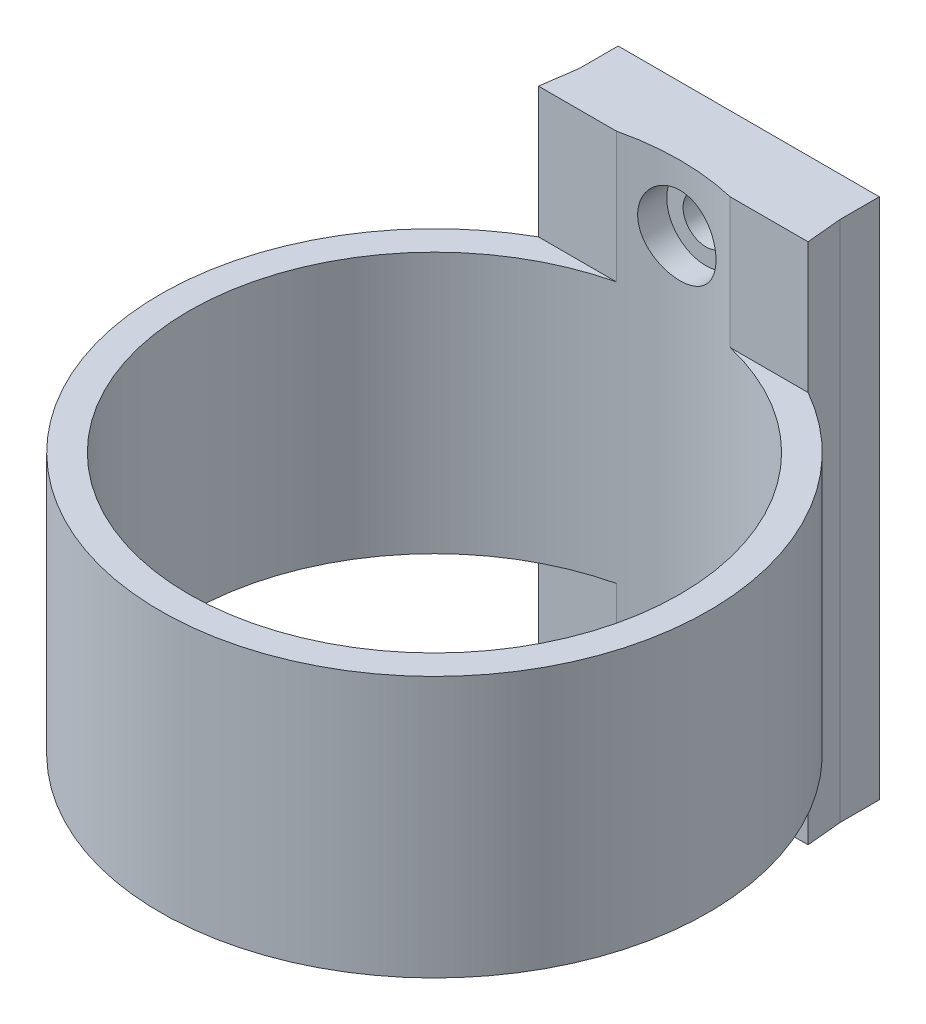
from build123d import *
from build123d.topology import SkipClean

# Parameters (mm, degrees)
SKETCH1_R               = 21
SKETCH1_R_2             = 18.8
BOSS_EXTRUDE1_DEPTH     = 20
SKETCH2_W               = 20
SKETCH2_H               = 40
SKETCH2_R               = 1.75
BOSS_EXTRUDE2_DEPTH     = 3
BOSS_EXTRUDE3_REACH     = 53.157
SKETCH6_R               = 1.75
CUT_EXTRUDE2_DEPTH      = 59.017238817
SKETCH8_R               = 3
CUT_EXTRUDE3_DEPTH      = 2.5
CUT_EXTRUDE4_DEPTH      = 44.783558558
CUT_EXTRUDE4_DEPTH_BACK = 44.783558558
SKETCH5_R               = 18.8


with BuildPart() as part:
    # Sketch1 → Boss-Extrude1 (new body)
    with BuildSketch(Plane(origin=(0, 0, 0), x_dir=(1, 0, 0), z_dir=(0, 1, 0))):
        with Locations(Location((0, 0, 0), (0, 0, 270))):
            Circle(SKETCH1_R)
        with Locations(Location((0, 0, 0), (0, 0, 270))):
            Circle(SKETCH1_R_2, mode=Mode.SUBTRACT)
    extrude(amount=BOSS_EXTRUDE1_DEPTH)


with BuildPart() as body_2:
    # Sketch2 → Boss-Extrude2 (new body)
    with BuildSketch(Plane(origin=(0, 0, -21), x_dir=(-1, 0, 0), z_dir=(0, 0, -1))):
        with Locations((-0.068597586, 10)):
            Rectangle(SKETCH2_W, SKETCH2_H)
        with Locations((0, 25)):
            Circle(SKETCH2_R, mode=Mode.SUBTRACT)
        with Locations((0, -5)):
            Circle(SKETCH2_R, mode=Mode.SUBTRACT)
    extrude(amount=BOSS_EXTRUDE2_DEPTH)

    # Boss-Extrude3: up to this face of the body (flat: up to its plane)
    boss_extrude3_end = Plane(body_2.part.faces().sort_by_distance((0.068597586, -10, -22.5))[0])
    # Sketch3 → Boss-Extrude3 (add, up to the picked face)
    with BuildSketch(Plane(origin=(0, 30, 0), x_dir=(1, 0, 0), z_dir=(0, 1, 0)), mode=Mode.PRIVATE) as boss_extrude3_sk1:
        Polygon((-9.931402414, 21), (-10.322711145, 18.287745477), (10.322711145, 18.287745477), (10.068597586, 21), align=None)
    boss_extrude3_tool1 = split(extrude(boss_extrude3_sk1.sketch, amount=-BOSS_EXTRUDE3_REACH, mode=Mode.PRIVATE), bisect_by=boss_extrude3_end, keep=Keep.BOTH, mode=Mode.PRIVATE)

    add(part.part)  # Boss-Extrude3 merges part
    add(boss_extrude3_tool1.solids().sort_by(Axis((0.034117, 30, -19.636695), (0, -1, 0)))[0])

    # Sketch6 → Cut-Extrude2 (cut, through all)
    with BuildSketch(Plane(origin=(0, 0, -24), x_dir=(-1, 0, 0), z_dir=(0, 0, -1))):
        with Locations(Location((0, 25, 0), (0, 0, 180))):
            Circle(SKETCH6_R)
        with Locations(Location((0, -5, 0), (0, 0, 180))):
            Circle(SKETCH6_R)
    extrude(amount=-CUT_EXTRUDE2_DEPTH, mode=Mode.SUBTRACT)

    # Sketch8 → Cut-Extrude3 (cut)
    with SkipClean():  # the faces are left unmerged after this step: merging them gives an invalid solid
        with BuildSketch(Plane.XY.offset(-18.287745477)):
            with Locations((0, 25)):
                Circle(SKETCH8_R)
            with Locations(Location((0, -5, 0), (0, 0, 180))):
                Circle(SKETCH8_R)
        extrude(amount=-CUT_EXTRUDE3_DEPTH, mode=Mode.SUBTRACT)

    # Sketch5 → Cut-Extrude4 (cut, two sides: drawn at the far end of the back side and taken through both)
    with SkipClean():  # the faces are left unmerged after this step: merging them gives an invalid solid
        with BuildSketch(Plane(origin=(0, 20, 0), x_dir=(1, 0, 0), z_dir=(0, 1, 0)).offset(-CUT_EXTRUDE4_DEPTH_BACK)):
            with Locations(Location((0, 0, 0), (0, 0, 103.405798669))):
                Circle(SKETCH5_R)
        extrude(amount=CUT_EXTRUDE4_DEPTH + CUT_EXTRUDE4_DEPTH_BACK, mode=Mode.SUBTRACT)


solid = body_2.part
